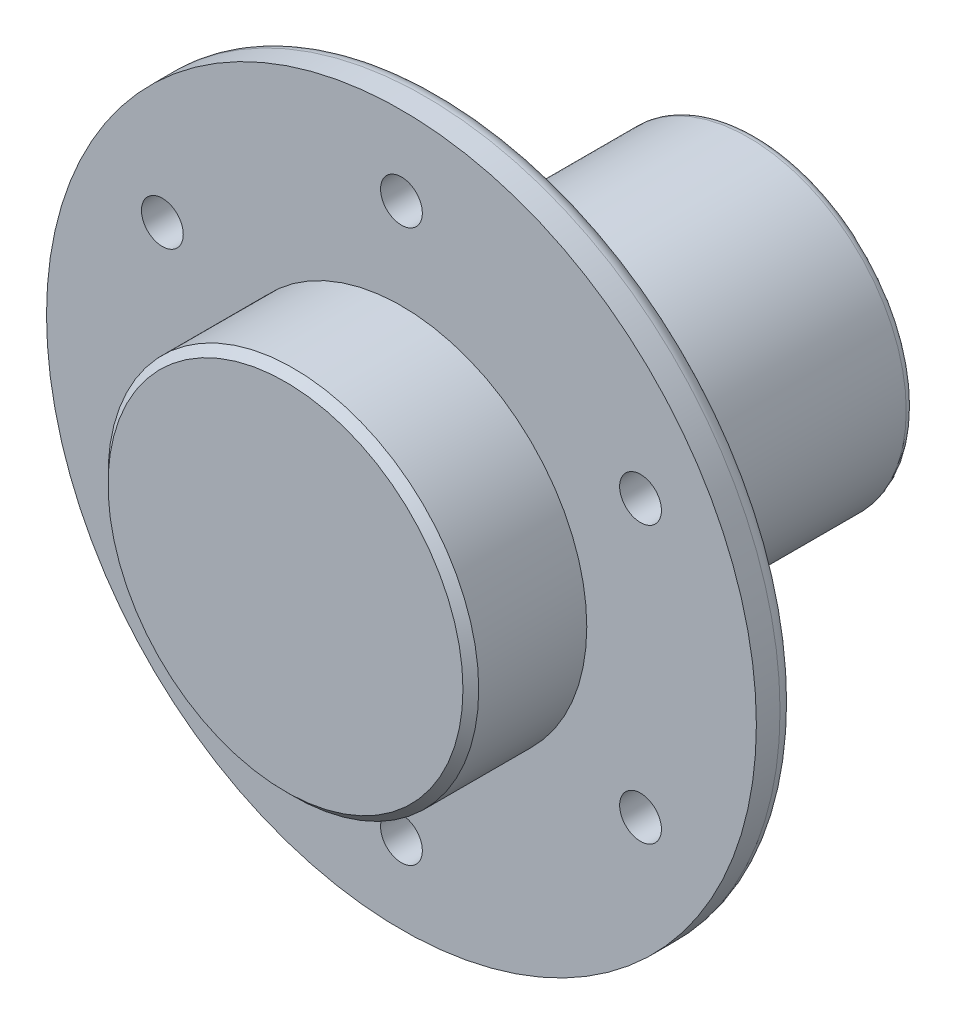
from build123d import *

# Parameters (mm, degrees)
SKETCH1_R           = 20
BOSS_EXTRUDE1_DEPTH = 40
SKETCH2_W           = 21.283914114
SKETCH2_H           = 21.283914114
CUT_EXTRUDE1_DEPTH  = 15
CHAMFER1_SIZE       = 0.8
SKETCH3_R           = 45
BOSS_EXTRUDE2_DEPTH = 5
SKETCH4_R           = 23.5
BOSS_EXTRUDE3_DEPTH = 14.7
CHAMFER2_SIZE       = 1
FILLET1_R           = 2
FILLET2_R           = 8
SKETCH5_R           = 2.65
CUT_EXTRUDE2_DEPTH  = 78.942286398
CIRPATTERN1_COUNT   = 6
FILLET3_R           = 1


with BuildPart() as part:
    # Sketch1 → Boss-Extrude1 (new body)
    with BuildSketch(Plane.XY):
        Circle(SKETCH1_R)
    extrude(amount=BOSS_EXTRUDE1_DEPTH)

    # Sketch2 → Cut-Extrude1 (cut)
    with BuildSketch(Plane(origin=(0, 0, 0), x_dir=(-1, 0, 0), z_dir=(0, 0, -1))):
        Rectangle(SKETCH2_W, SKETCH2_H)
    extrude(amount=-CUT_EXTRUDE1_DEPTH, mode=Mode.SUBTRACT)

    # Chamfer1
    chamfer1_edges = [part.edges().sort_by_distance(p)[0] for p in [
        (0, -10.641957057, 0),
        (-10.641957057, 0, 0),
        (0, 10.641957057, 0),
        (10.641957057, 0, 0),
    ]]
    chamfer(chamfer1_edges, length=CHAMFER1_SIZE)

    # Sketch3 → Boss-Extrude2 (add)
    with BuildSketch(Plane.XY.offset(40)):
        Circle(SKETCH3_R)
    extrude(amount=BOSS_EXTRUDE2_DEPTH)

    # Sketch4 → Boss-Extrude3 (add)
    with BuildSketch(Plane.XY.offset(45)):
        Circle(SKETCH4_R)
    extrude(amount=BOSS_EXTRUDE3_DEPTH)

    # Chamfer2
    chamfer2_edges = [part.edges().sort_by_distance(p)[0] for p in [
        (-23.5, 0, 59.7),
    ]]
    chamfer(chamfer2_edges, length=CHAMFER2_SIZE)

    # Fillet1
    fillet1_edges = [part.edges().sort_by_distance(p)[0] for p in [
        (-45, 0, 40),
    ]]
    fillet(fillet1_edges, radius=FILLET1_R)

    # Fillet2
    fillet2_edges = [part.edges().sort_by_distance(p)[0] for p in [
        (-20, 0, 40),
    ]]
    fillet(fillet2_edges, radius=FILLET2_R)

    # Sketch5 → Cut-Extrude2 (cut, through all)
    with BuildSketch(Plane.XY.offset(45)):
        with Locations((0, 35)):
            Circle(SKETCH5_R)
    cut_extrude2 = extrude(amount=-CUT_EXTRUDE2_DEPTH, mode=Mode.SUBTRACT)

    # CirPattern1: Cut-Extrude2 ×6 about axis
    cirpattern1_axis = Axis((0, 0, 0), (0, 0, 1))
    for i in range(1, CIRPATTERN1_COUNT):
        add(cut_extrude2.rotate(cirpattern1_axis, i * 360 / CIRPATTERN1_COUNT), mode=Mode.SUBTRACT)

    # Fillet3
    fillet3_edges = [part.edges().sort_by_distance(p)[0] for p in [
        (-20, 0, 0),
    ]]
    fillet(fillet3_edges, radius=FILLET3_R)


solid = part.part
